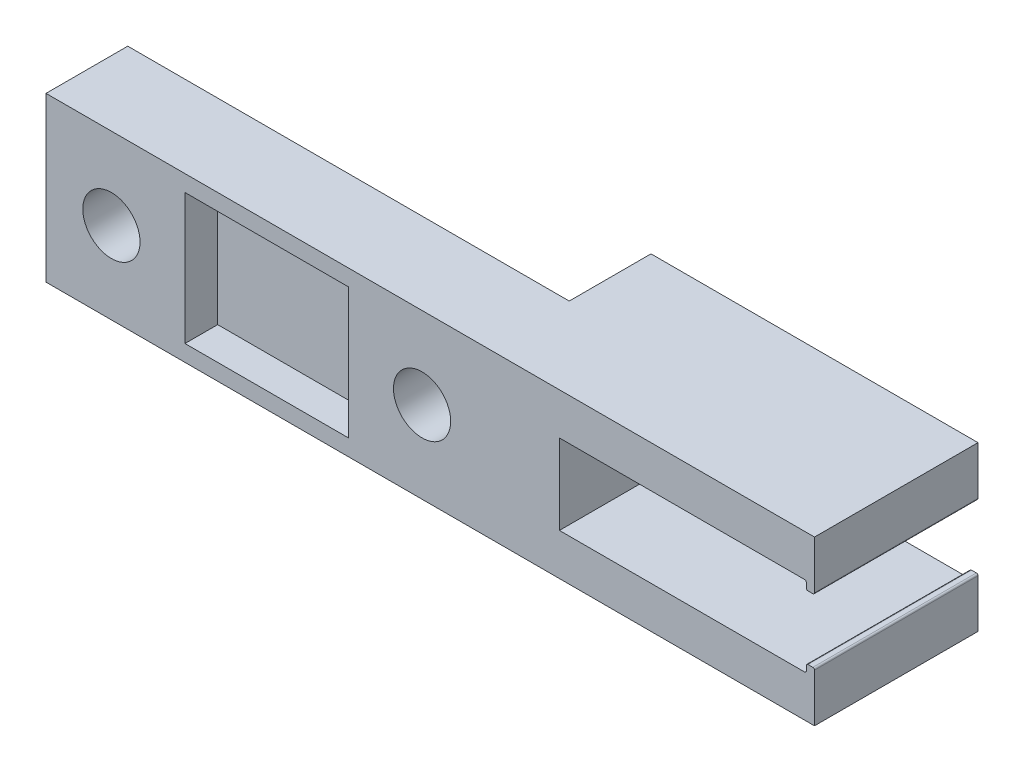
from build123d import *

# Parameters (mm, degrees)
SKETCH1_W           = 0.5
SKETCH1_H           = 0.5
BOSS_EXTRUDE1_DEPTH = 10
SKETCH2_W           = 27
SKETCH2_H           = 10
SKETCH2_R           = 1.75
BOSS_EXTRUDE2_DEPTH = 5
SKETCH3_W           = 10
SKETCH3_H           = 8
CUT_EXTRUDE3_DEPTH  = 2
FILLET1_R           = 0.1
FILLET2_R           = 0.1


with BuildPart() as part:
    # Sketch1 → Boss-Extrude1 (new body)
    with BuildSketch(Plane.XY):
        Polygon((20, 0), (0, 0), (0, -10), (20, -10), (20, -7.45), (19.5, -7.45), (4.4, -7.45), (4.4, -2.55), (19.5, -2.55), (20, -2.55), align=None)
        with Locations((19.75, -7.2)):
            Rectangle(SKETCH1_W, SKETCH1_H)
        with Locations((19.75, -2.8)):
            Rectangle(SKETCH1_W, SKETCH1_H)
    extrude(amount=BOSS_EXTRUDE1_DEPTH)

    # Sketch2 → Boss-Extrude2 (add)
    with BuildSketch(Plane.XY.offset(10)):
        with Locations((-13.5, -5)):
            Rectangle(SKETCH2_W, SKETCH2_H)
        with Locations((-23, -5)):
            Circle(SKETCH2_R, mode=Mode.SUBTRACT)
        with Locations((-4, -5)):
            Circle(SKETCH2_R, mode=Mode.SUBTRACT)
    extrude(amount=-BOSS_EXTRUDE2_DEPTH)

    # Sketch3 → Cut-Extrude3 (cut)
    with BuildSketch(Plane.XY.offset(10)):
        with Locations((-13.5, -5)):
            Rectangle(SKETCH3_W, SKETCH3_H)
    extrude(amount=-CUT_EXTRUDE3_DEPTH, mode=Mode.SUBTRACT)

    # Fillet1
    fillet1_edges = [part.edges().sort_by_distance(p)[0] for p in [
        (19.5, -7.45, 5),
        (19.5, -2.55, 5),
    ]]
    fillet(fillet1_edges, radius=FILLET1_R)

    # Fillet2
    fillet2_edges = [part.edges().sort_by_distance(p)[0] for p in [
        (19.5, -6.95, 5),
        (20, -6.95, 5),
        (20, -3.05, 5),
        (19.5, -3.05, 5),
    ]]
    fillet(fillet2_edges, radius=FILLET2_R)


solid = part.part
